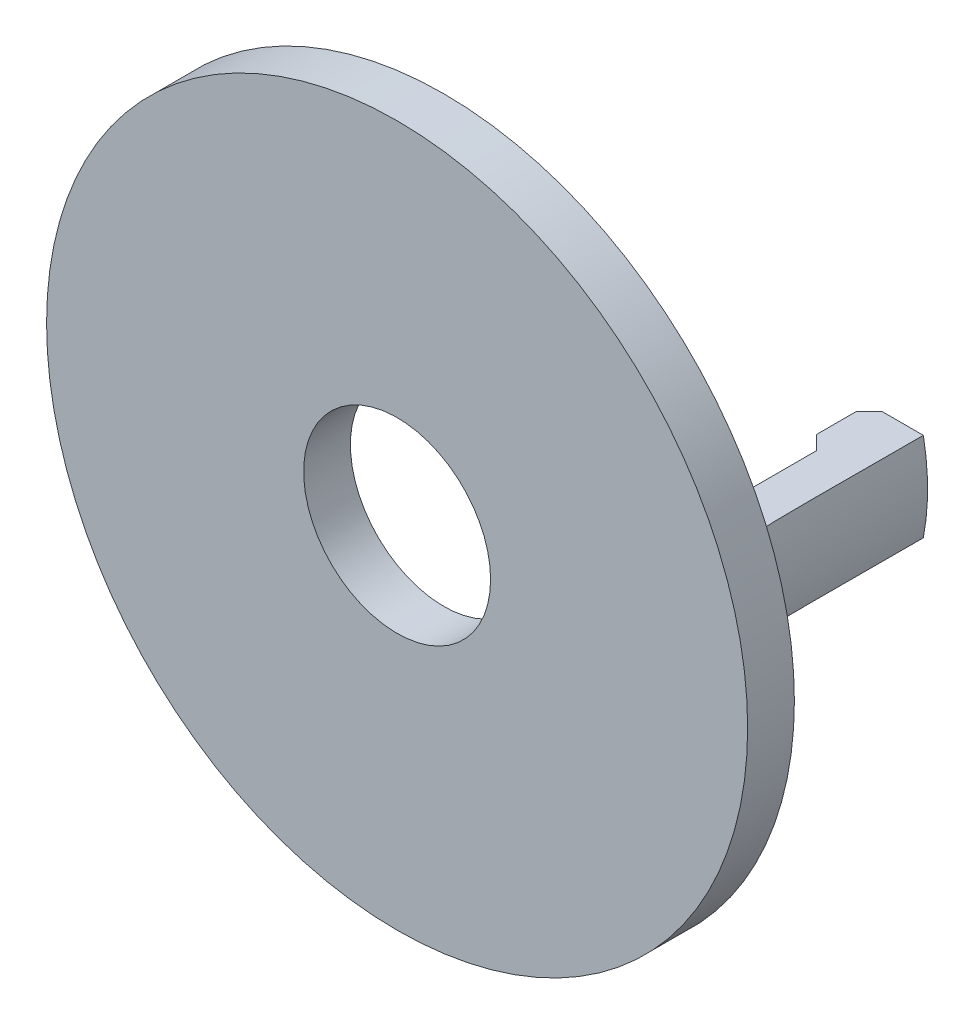
from build123d import *

# Parameters (mm, degrees)
SKETCH4_R           = 37.5
BOSS_EXTRUDE2_DEPTH = 5
SKETCH5_R           = 10
CUT_EXTRUDE1_DEPTH  = 54.268189382
BOSS_EXTRUDE3_DEPTH = 4.75
SKETCH1_R           = 37.5
CUT_EXTRUDE2_DEPTH  = 60.397495738


with BuildPart() as part:
    # Sketch4 → Boss-Extrude2 (new body)
    with BuildSketch(Plane.XY):
        Circle(SKETCH4_R)
    extrude(amount=BOSS_EXTRUDE2_DEPTH)

    # Sketch5 → Cut-Extrude1 (cut, through all)
    with BuildSketch(Plane.XY.offset(5)):
        Circle(SKETCH5_R)
    extrude(amount=-CUT_EXTRUDE1_DEPTH, mode=Mode.SUBTRACT)

    # Sketch6 → Boss-Extrude3 (add, symmetric)
    with BuildSketch(Plane(origin=(0, 0, 0), x_dir=(1, 0, 0), z_dir=(0, 1, 0))):
        Polygon((20.25, 2.896446609), (17.353553391, 0), (26.5, 0), (26.5, 26.75), (20.103553391, 26.75), (18.75, 25.396446609), (18.75, 21.103553391), (20.25, 19.603553391), align=None)
    boss_extrude3 = extrude(amount=BOSS_EXTRUDE3_DEPTH, both=True)

    # Sketch1 → Cut-Extrude2 (cut, through all)
    with BuildSketch(Plane.XY):
        Circle(SKETCH1_R)
        with BuildLine():
            ThreePointArc((-1, 26.481125354), (18.381376445, 19.088609169), (26.5, 0))
            ThreePointArc((26.5, 0), (18.381376445, -19.088609169), (-1, -26.481125354))
            ThreePointArc((-1, -26.481125354), (-28.5, 0), (-1, 26.481125354))
        make_face(mode=Mode.SUBTRACT)
    cut_extrude2 = extrude(amount=-CUT_EXTRUDE2_DEPTH, mode=Mode.SUBTRACT)

    # Sketch6<4> → Cut-Revolve1 (revolve, cut)
    with BuildSketch(Plane(origin=(0, 0, 0), x_dir=(1, 0, 0), z_dir=(0, 1, 0))):
        with BuildLine():
            add(Edge.make_bspline(
                [(25, 26.75), (25, 22.72818992), (24.990050178, 20.542467854), (25.01194908, 14.942357728), (24.774871471, 4.983935506), (26.5, 0)],
                knots=[0, 0, 0, 0, 0.44660472, 0.54660472, 1, 1, 1, 1], degree=3))
            Line((26.5, 0), (26.5, 26.75))
            Line((26.5, 26.75), (25, 26.75))
        make_face()
    cut_revolve1 = revolve(axis=Axis((0, 0, 0), (0, 0, -1)), mode=Mode.SUBTRACT)

    # Mirror1: Boss-Extrude3, Cut-Extrude2, Cut-Revolve1 across plane
    add(boss_extrude3.mirror(Plane(origin=(0, 0, 0), x_dir=(0, 0, 1), z_dir=(1, 0, 0))))
    add(cut_extrude2.mirror(Plane(origin=(0, 0, 0), x_dir=(0, 0, 1), z_dir=(1, 0, 0))), mode=Mode.SUBTRACT)
    add(cut_revolve1.mirror(Plane(origin=(0, 0, 0), x_dir=(0, 0, 1), z_dir=(1, 0, 0))), mode=Mode.SUBTRACT)


solid = part.part
